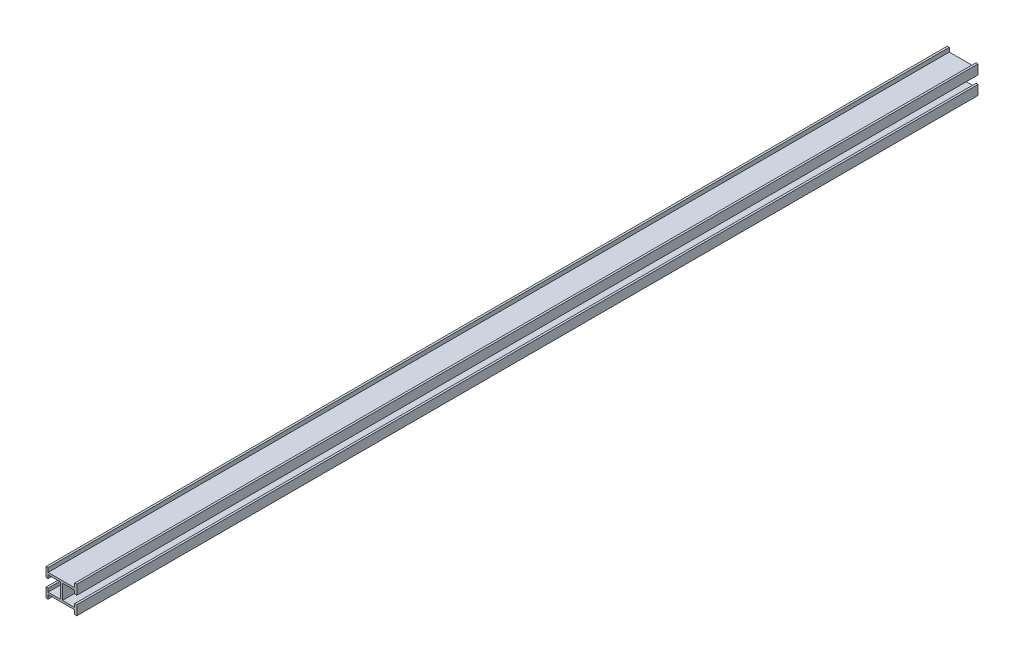
from build123d import *

# Parameters (mm, degrees)
BOSS_EXTRUDE1_DEPTH = 659


with BuildPart() as part:
    # Sketch1 → Boss-Extrude1 (new, symmetric)
    with BuildSketch(Plane.XY):
        Polygon((-19.5, 14), (19.5, 14), (19.5, 20), (22.5, 20), (22.5, 6), (19.5, 6), (19.5, 11), (1.5, 11), (1.5, -11), (19.5, -11), (19.5, -6), (22.5, -6), (22.5, -20), (19.5, -20), (19.5, -14), (-19.5, -14), (-19.5, -20), (-22.5, -20), (-22.5, -6), (-19.5, -6), (-19.5, -11), (-1.5, -11), (-1.5, 11), (-19.5, 11), (-19.5, 6), (-22.5, 6), (-22.5, 20), (-19.5, 20), align=None)
    extrude(amount=BOSS_EXTRUDE1_DEPTH, both=True)


solid = part.part
